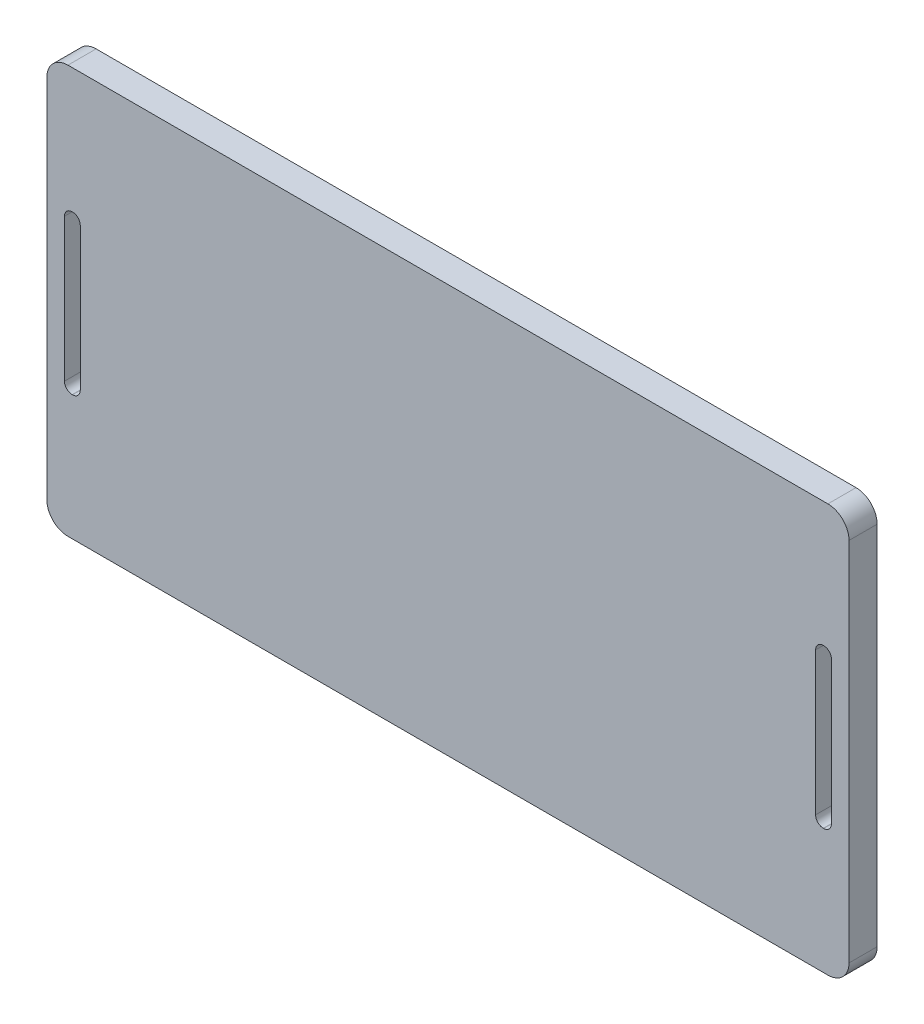
from build123d import *

# Parameters (mm, degrees)
SALIENTE_EXTRUIR1_DEPTH = 8
CORTAR_EXTRUIR1_DEPTH   = 10


with BuildPart() as part:
    # Croquis2 → Saliente-Extruir1 (new body)
    with BuildSketch(Plane.XY):
        with BuildLine():
            Line((614.835603051, 709.114300051), (830.835603051, 709.114300051))
            ThreePointArc((830.835603051, 709.114300051), (835.078243738, 710.871659363), (836.835603051, 715.114300051))
            Line((836.835603051, 715.114300051), (836.835603051, 819.114300051))
            ThreePointArc((836.835603051, 819.114300051), (835.078243738, 823.356940738), (830.835603051, 825.114300051))
            Line((830.835603051, 825.114300051), (614.835603051, 825.114300051))
            ThreePointArc((614.835603051, 825.114300051), (610.592962364, 823.356940738), (608.835603051, 819.114300051))
            Line((608.835603051, 819.114300051), (608.835603051, 715.114300051))
            ThreePointArc((608.835603051, 715.114300051), (610.592962364, 710.871659363), (614.835603051, 709.114300051))
        make_face()
    extrude(amount=SALIENTE_EXTRUIR1_DEPTH)

    # Croquis3 → Cortar-Extruir1 (cut)
    with BuildSketch(Plane(origin=(0, 0, 0), x_dir=(-1, 0, 0), z_dir=(0, 0, -1))):
        with BuildLine():
            Line((-616.135603051, 744.614300051), (-616.035603051, 744.614300051))
            ThreePointArc((-616.035603051, 744.614300051), (-614.479968132, 745.258665132), (-613.835603051, 746.814300051))
            Line((-613.835603051, 746.814300051), (-613.835603051, 787.414300051))
            ThreePointArc((-613.835603051, 787.414300051), (-614.479968132, 788.969934969), (-616.035603051, 789.614300051))
            Line((-616.035603051, 789.614300051), (-616.135603051, 789.614300051))
            ThreePointArc((-616.135603051, 789.614300051), (-617.691237969, 788.969934969), (-618.335603051, 787.414300051))
            Line((-618.335603051, 787.414300051), (-618.335603051, 746.814300051))
            ThreePointArc((-618.335603051, 746.814300051), (-617.691237969, 745.258665132), (-616.135603051, 744.614300051))
        make_face()
        with BuildLine():
            Line((-829.535603051, 789.614300051), (-829.635603051, 789.614300051))
            ThreePointArc((-829.635603051, 789.614300051), (-831.191237969, 788.969934969), (-831.835603051, 787.414300051))
            Line((-831.835603051, 787.414300051), (-831.835603051, 746.814300051))
            ThreePointArc((-831.835603051, 746.814300051), (-831.191237969, 745.258665132), (-829.635603051, 744.614300051))
            Line((-829.635603051, 744.614300051), (-829.535603051, 744.614300051))
            ThreePointArc((-829.535603051, 744.614300051), (-827.979968132, 745.258665132), (-827.335603051, 746.814300051))
            Line((-827.335603051, 746.814300051), (-827.335603051, 787.414300051))
            ThreePointArc((-827.335603051, 787.414300051), (-827.979968132, 788.969934969), (-829.535603051, 789.614300051))
        make_face()
    extrude(amount=-CORTAR_EXTRUIR1_DEPTH, mode=Mode.SUBTRACT)


solid = part.part
